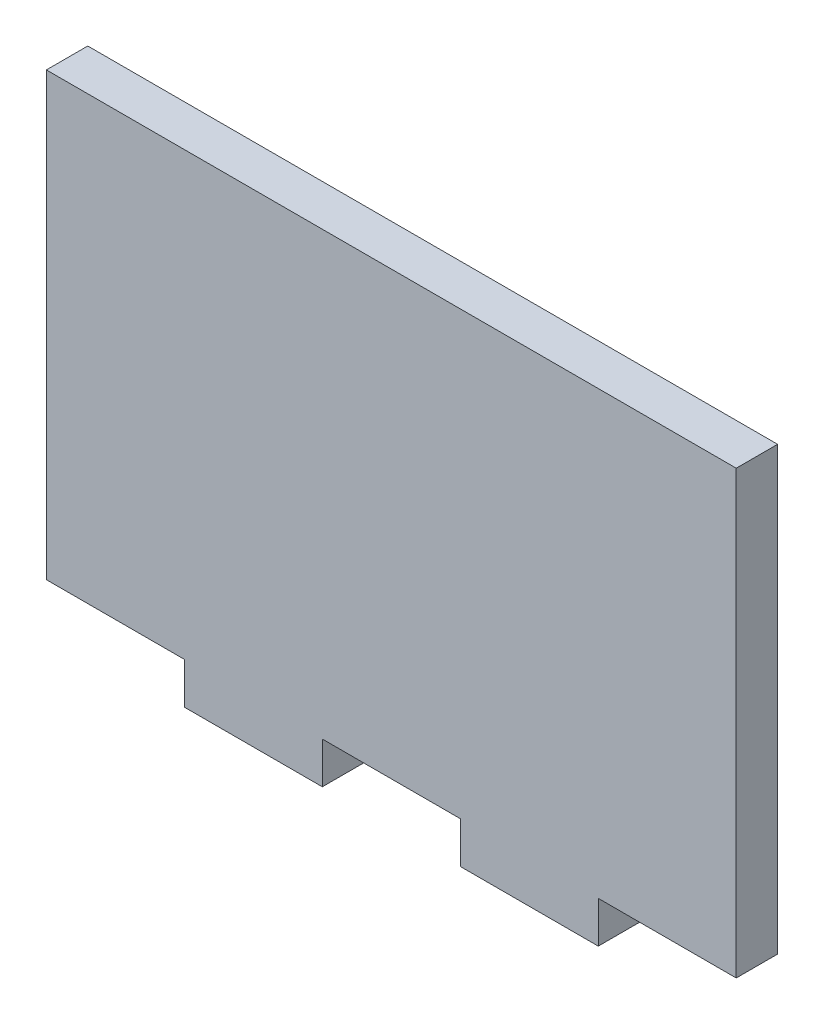
from build123d import *

# Parameters (mm, degrees)
ESQUISSE1_W        = 100
ESQUISSE1_H        = 64
BOSS_EXTRU_1_DEPTH = 6
ESQUISSE2_W        = 20
ESQUISSE2_H        = 6
BOSS_EXTRU_2_DEPTH = 6


with BuildPart() as part:
    # Esquisse1 → Boss.-Extru.1 (new body)
    with BuildSketch(Plane.XY):
        with Locations((-50, 32)):
            Rectangle(ESQUISSE1_W, ESQUISSE1_H)
    extrude(amount=BOSS_EXTRU_1_DEPTH)

    # Esquisse2 → Boss.-Extru.2 (add)
    with BuildSketch(Plane.XZ):
        with Locations((-70, 3)):
            Rectangle(ESQUISSE2_W, ESQUISSE2_H)
        with Locations((-30, 3)):
            Rectangle(ESQUISSE2_W, ESQUISSE2_H)
    extrude(amount=BOSS_EXTRU_2_DEPTH)


solid = part.part
